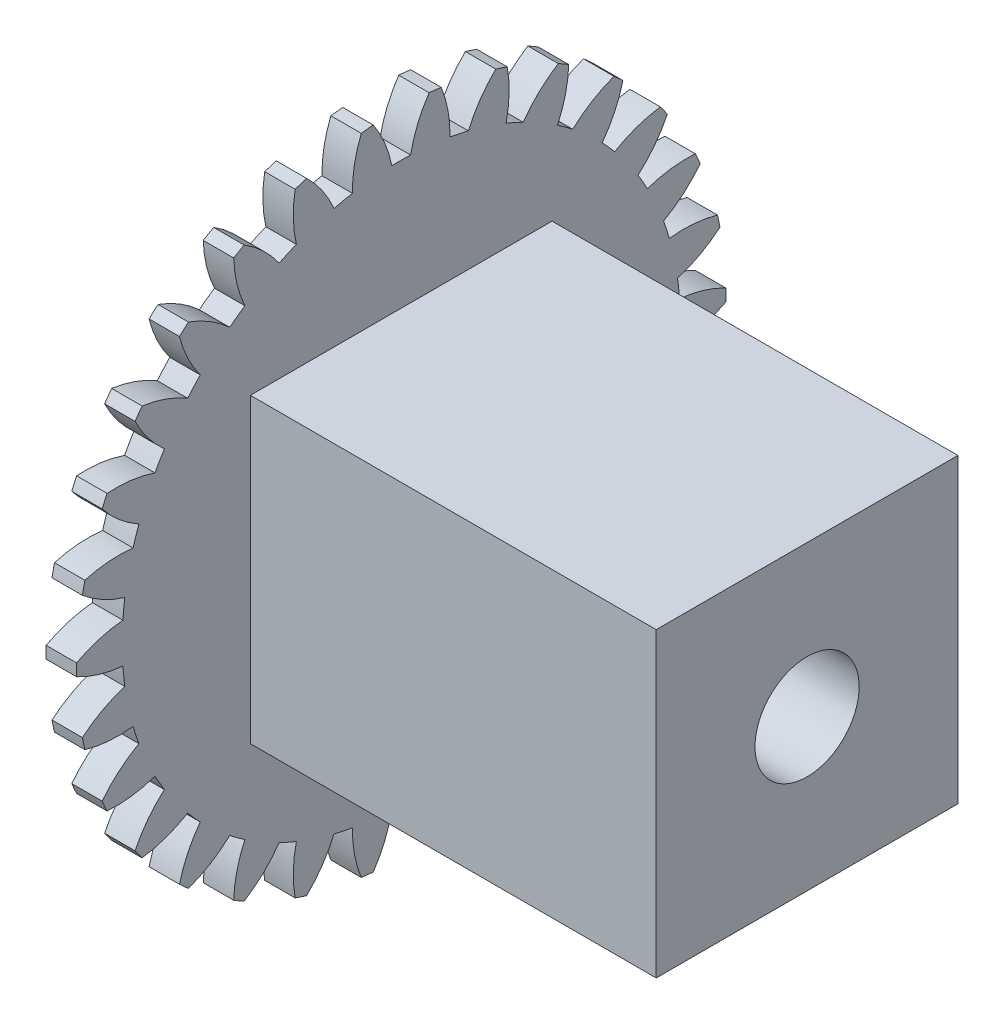
from build123d import *

# Parameters (mm, degrees)
BASPROSKE_W         = 4.5
BASPROSKE_H         = 48
TOOTHCUT_DEPTH      = 69.031242823
TEETHCUTS_COUNT     = 30
TEETHCUTS_ANGLE     = 348
BORSKE_R            = 5
BORE_DEPTH          = 50.0000508
BOSS_EXTRUDE2_DEPTH = 60
SKETCH6_R           = 7.7
CUT_EXTRUDE2_DEPTH  = 94.547796729


with BuildPart() as part:
    # BasProSke → Base-Revolve (revolve)
    with BuildSketch(Plane(origin=(0, 0, 0), x_dir=(1, 0, 0), z_dir=(0, 1, 0)), mode=Mode.PRIVATE) as base_revolve_sk:
        with Locations((2.25, 24)):
            Rectangle(BASPROSKE_W, BASPROSKE_H)
    revolve(base_revolve_sk.sketch.rotate(Axis((-10, 0, 0), (1, 0, 0)), 180), axis=Axis((-10, 0, 0), (1, 0, 0)))

    # TooCutSke → ToothCut (cut, through all)
    with BuildSketch(Plane(origin=(0, 0, 0), x_dir=(0, 0, -1), z_dir=(1, 0, 0))):
        with BuildLine():
            ThreePointArc((1.388358102, 41.225628713), (0, 41.249), (-1.388358102, 41.225628713))
            ThreePointArc((-1.388358102, 41.225628713), (-2.434419088, 44.674608087), (-4.146627223, 47.846050285))
            ThreePointArc((-4.146627223, 47.846050285), (0, 48.0254), (4.146627223, 47.846050285))
            ThreePointArc((4.146627223, 47.846050285), (2.434419088, 44.674608087), (1.388358102, 41.225628713))
        make_face()
    toothcut = extrude(amount=TOOTHCUT_DEPTH, mode=Mode.SUBTRACT)

    # TeethCuts: ToothCut ×30 about axis
    teethcuts_axis = Axis((-10, 0, 0), (1, 0, 0))
    for i in range(1, TEETHCUTS_COUNT):
        add(toothcut.rotate(teethcuts_axis, i * TEETHCUTS_ANGLE / (TEETHCUTS_COUNT - 1)), mode=Mode.SUBTRACT)

    # BorSke → Bore (cut, symmetric)
    with BuildSketch(Plane(origin=(0, 0, 0), x_dir=(0, 0, -1), z_dir=(1, 0, 0))):
        with Locations(Location((0, 0, 0), (0, 0, 180))):
            Circle(BORSKE_R)
    extrude(amount=BORE_DEPTH, both=True, mode=Mode.SUBTRACT)

    # Sketch5 → Boss-Extrude2 (add)
    with BuildSketch(Plane(origin=(4.5, 0, 0), x_dir=(0, 0, -1), z_dir=(1, 0, 0))):
        Polygon((22.3, 22.3), (22.3, -22.3), (-22.3, 22.3), align=None)
        Polygon((-22.3, 22.3), (-22.3, -22.3), (22.3, -22.3), align=None)
    extrude(amount=BOSS_EXTRUDE2_DEPTH)

    # Sketch6 → Cut-Extrude2 (cut, through all)
    with BuildSketch(Plane.ZY):
        Circle(SKETCH6_R)
    extrude(amount=-CUT_EXTRUDE2_DEPTH, mode=Mode.SUBTRACT)


solid = part.part
